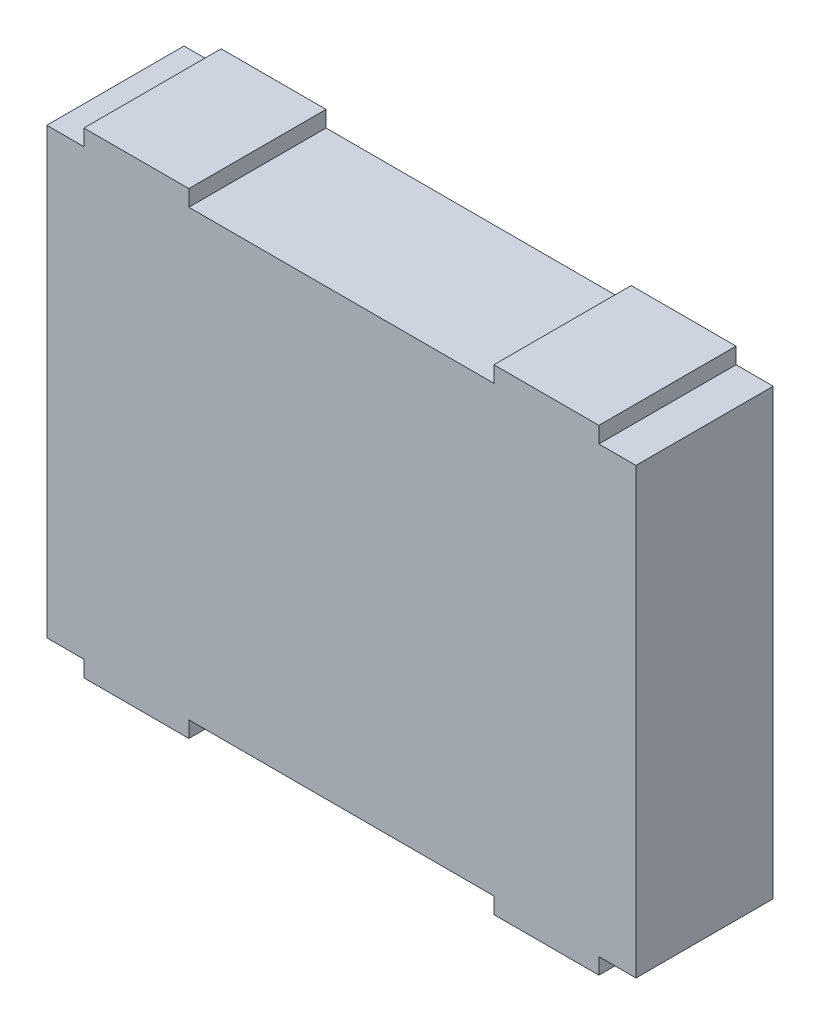
from build123d import *

# Parameters (mm, degrees)
COMPONENT_OUTLINE_DEPTH = 1.7


with BuildPart() as part:
    # 草图1 → Component_Outline (new body)
    with BuildSketch(Plane.XY):
        Polygon((3.19, 2.95), (3.19, 2.75), (3.65, 2.75), (3.65, -2.75), (3.19, -2.75), (3.19, -2.95), (1.89, -2.95), (1.89, -2.75), (-1.89, -2.75), (-1.89, -2.95), (-3.19, -2.95), (-3.19, -2.75), (-3.65, -2.75), (-3.65, 2.75), (-3.19, 2.75), (-3.19, 2.95), (-1.89, 2.95), (-1.89, 2.75), (1.89, 2.75), (1.89, 2.95), align=None)
    extrude(amount=COMPONENT_OUTLINE_DEPTH)


solid = part.part
